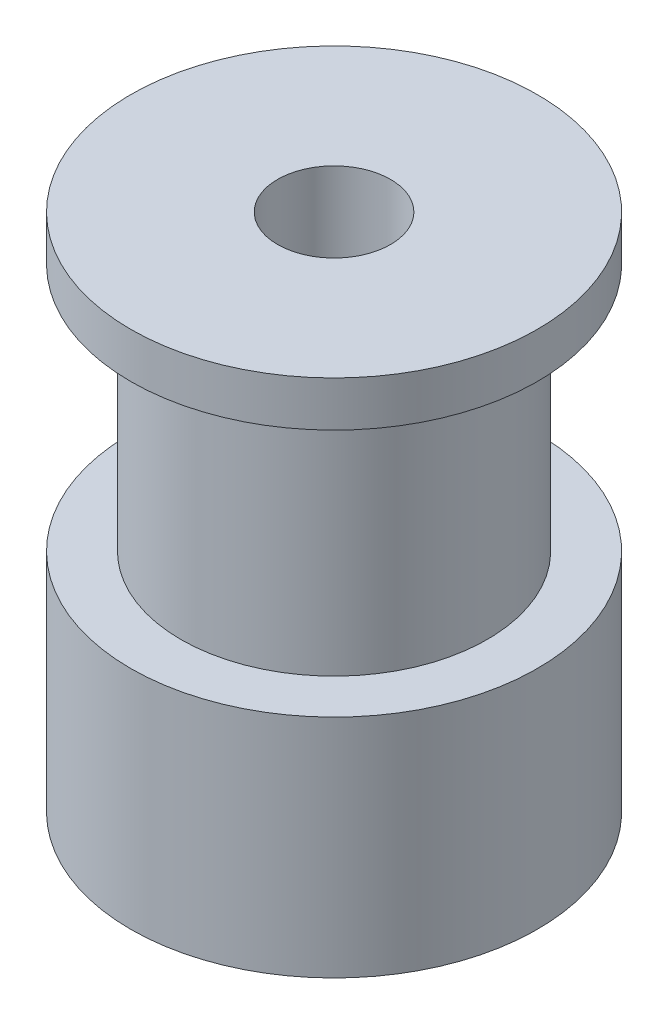
from build123d import *

# Parameters (mm, degrees)
SKETCH_1_R          = 9
EXTRUDE_1_DEPTH     = 8
SKETCH_2_R          = 9
EXTRUDE_2_DEPTH     = 2
SKETCH_3_R          = 6.78
EXTRUDE_3_DEPTH     = 11
SKETCH_4_R          = 9
EXTRUDE_4_DEPTH     = 2
SKETCH_5_R          = 2.5
CUT_EXTRUDE_1_DEPTH = 31


with BuildPart() as part:
    # 草图1 → 凸台-拉伸1 (new body)
    with BuildSketch(Plane(origin=(0, 0, 0), x_dir=(1, 0, 0), z_dir=(0, 1, 0))):
        with Locations(Location((0, 0, 0), (0, 0, 270))):
            Circle(SKETCH_1_R)
    extrude(amount=EXTRUDE_1_DEPTH)

    # 草图2 → 凸台-拉伸2 (add)
    with BuildSketch(Plane(origin=(0, 8, 0), x_dir=(1, 0, 0), z_dir=(0, 1, 0))):
        with Locations(Location((0, 0, 0), (0, 0, 270))):
            Circle(SKETCH_2_R)
    extrude(amount=EXTRUDE_2_DEPTH)

    # 草图3 → 凸台-拉伸3 (add)
    with BuildSketch(Plane(origin=(0, 10, 0), x_dir=(1, 0, 0), z_dir=(0, 1, 0))):
        with Locations(Location((0, 0, 0), (0, 0, 270))):
            Circle(SKETCH_3_R)
    extrude(amount=EXTRUDE_3_DEPTH)

    # 草图4 → 凸台-拉伸4 (add)
    with BuildSketch(Plane(origin=(0, 21, 0), x_dir=(1, 0, 0), z_dir=(0, 1, 0))):
        with Locations(Location((0, 0, 0), (0, 0, 270))):
            Circle(SKETCH_4_R)
    extrude(amount=EXTRUDE_4_DEPTH)

    # 草图5 → 切除-拉伸1 (cut)
    with BuildSketch(Plane(origin=(0, 23, 0), x_dir=(1, 0, 0), z_dir=(0, 1, 0))):
        with Locations(Location((0, 0, 0), (0, 0, 270))):
            Circle(SKETCH_5_R)
    extrude(amount=-CUT_EXTRUDE_1_DEPTH, mode=Mode.SUBTRACT)


solid = part.part
